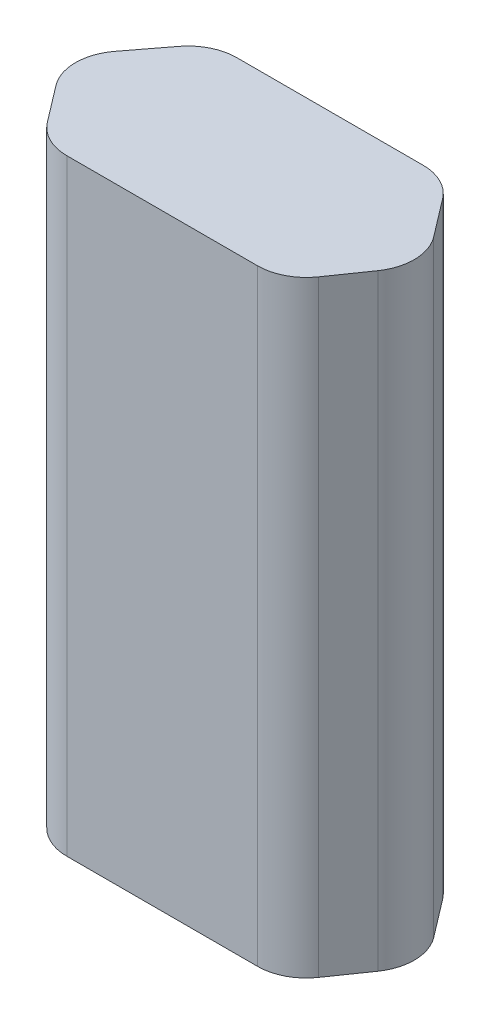
from build123d import *

# Parameters (mm, degrees)
BOSS_EXTRUDE1_DEPTH = 25
FILLET1_R           = 2


with BuildPart() as part:
    # Sketch1 → Boss-Extrude1 (new body)
    with BuildSketch(Plane(origin=(0, 0, 0), x_dir=(1, 0, 0), z_dir=(0, 1, 0))):
        Polygon((-7.5, 0), (-4.83125, 3.5), (4.83125, 3.5), (7.5, 0), (5.06875, -3.5), (-4.83125, -3.5), align=None)
    extrude(amount=BOSS_EXTRUDE1_DEPTH)

    # Fillet1
    fillet1_edges = [part.edges().sort_by_distance(p)[0] for p in [
        (-7.5, 12.5, 0),
        (-4.83125, 12.5, -3.5),
        (4.83125, 12.5, -3.5),
        (7.5, 12.5, 0),
        (5.06875, 12.5, 3.5),
        (-4.83125, 12.5, 3.5),
    ]]
    fillet(fillet1_edges, radius=FILLET1_R)


solid = part.part
